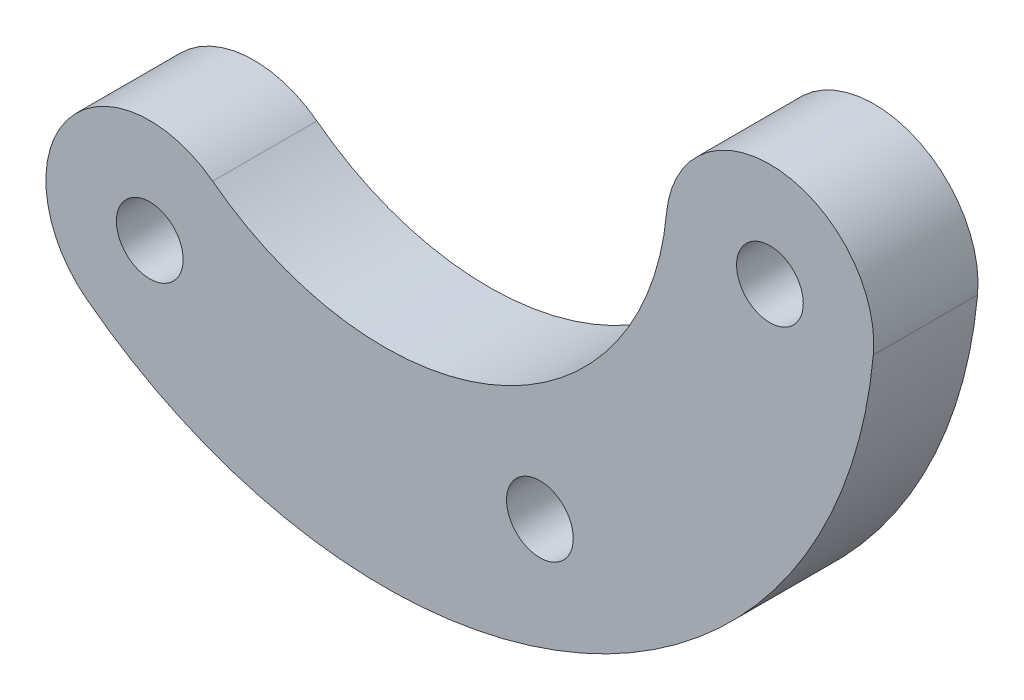
from build123d import *

# Parameters (mm, degrees)
SKETCH_1_R      = 1.6
EXTRUDE_1_DEPTH = 5


with BuildPart() as part:
    # 草图1 → 凸台-拉伸1 (new body)
    with BuildSketch(Plane.XY):
        with BuildLine():
            ThreePointArc((-3.016005594, -3.963654581), (20.711469165, -6.788370191), (34.699500163, 12.584473316))
            ThreePointArc((34.699500163, 12.584473316), (30.205119406, 18.007962633), (24.781630088, 13.513581877))
            ThreePointArc((24.781630088, 13.513581877), (16.709135129, 2.333510745), (3.016005594, 3.963654581))
            ThreePointArc((3.016005594, 3.963654581), (-3.963654581, 3.016005594), (-3.016005594, -3.963654581))
        make_face()
        Circle(SKETCH_1_R, mode=Mode.SUBTRACT)
        with Locations((29.740565125, 13.049027596)):
            Circle(SKETCH_1_R, mode=Mode.SUBTRACT)
        with Locations((18.710302147, -2.227429723)):
            Circle(SKETCH_1_R, mode=Mode.SUBTRACT)
    extrude(amount=EXTRUDE_1_DEPTH)


solid = part.part
